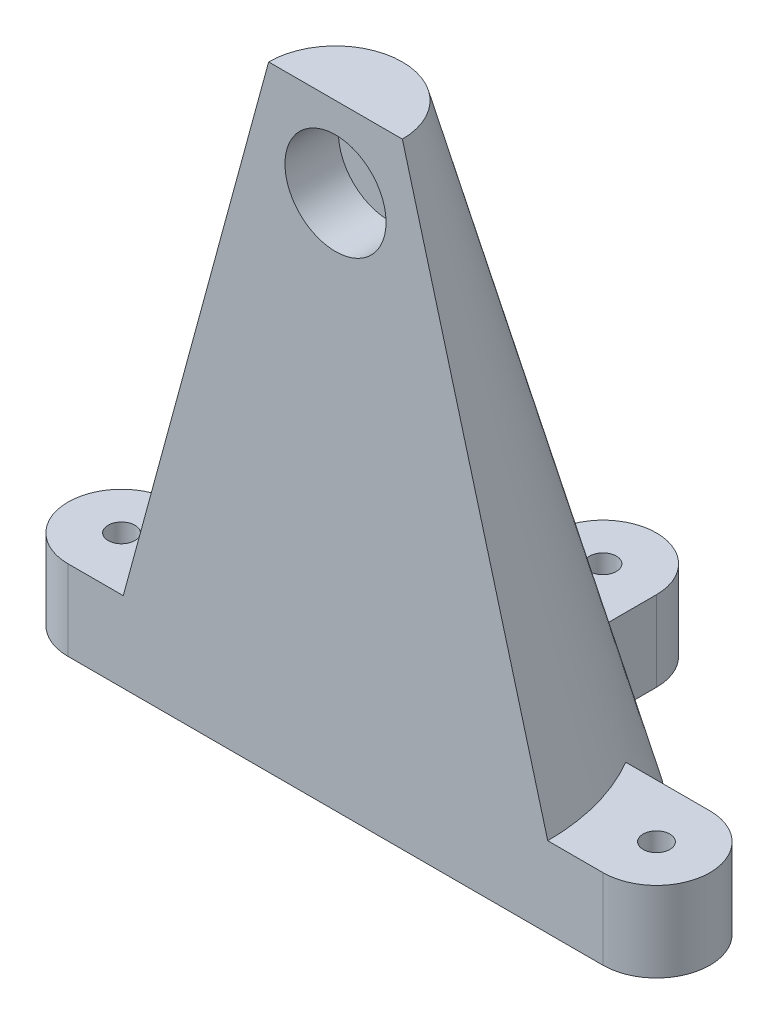
from build123d import *

# Parameters (mm, degrees)
SKETCH3_R           = 1.27
BOSS_EXTRUDE1_DEPTH = 7.62
SKETCH4_R           = 4.8006
CUT_EXTRUDE1_DEPTH  = 5.08


with BuildPart() as part:
    # Sketch1 → Loft1 section 0
    with BuildSketch(Plane(origin=(0, 0, 0), x_dir=(1, 0, 0), z_dir=(0, 1, 0))):
        with BuildLine():
            Line((-22.225, 0), (22.225, 0))
            ThreePointArc((22.225, 0), (0, 22.225), (-22.225, 0))
        make_face()
    # Sketch2 → Loft1 section 1
    with BuildSketch(Plane(origin=(0, 58.42, 0), x_dir=(1, 0, 0), z_dir=(0, 1, 0))):
        with BuildLine():
            Line((-6.35, 0), (6.35, 0))
            ThreePointArc((6.35, 0), (0, 6.35), (-6.35, 0))
        make_face()
    loft()

    # Sketch3 → Boss-Extrude1 (add)
    with BuildSketch(Plane(origin=(0, 0, 0), x_dir=(1, 0, 0), z_dir=(0, 1, 0))):
        with BuildLine():
            Line((5.08, 25.4), (5.08, 10.16))
            Line((5.08, 10.16), (25.4, 10.16))
            ThreePointArc((25.4, 10.16), (30.48, 5.08), (25.4, 0))
            Line((25.4, 0), (-25.4, 0))
            ThreePointArc((-25.4, 0), (-30.48, 5.08), (-25.4, 10.16))
            Line((-25.4, 10.16), (-5.08, 10.16))
            Line((-5.08, 10.16), (-5.08, 25.4))
            ThreePointArc((-5.08, 25.4), (0, 30.48), (5.08, 25.4))
        make_face()
        with Locations(Location((25.4, 5.08, 0), (0, 0, 90))):
            Circle(SKETCH3_R, mode=Mode.SUBTRACT)
        with Locations(Location((-25.4, 5.08, 0), (0, 0, 90))):
            Circle(SKETCH3_R, mode=Mode.SUBTRACT)
        with Locations(Location((0, 25.4, 0), (0, 0, 90))):
            Circle(SKETCH3_R, mode=Mode.SUBTRACT)
    extrude(amount=BOSS_EXTRUDE1_DEPTH)

    # Sketch4 → Cut-Extrude1 (cut)
    with BuildSketch(Plane.XY):
        with Locations((0, 50.8)):
            Circle(SKETCH4_R)
    extrude(amount=-CUT_EXTRUDE1_DEPTH, mode=Mode.SUBTRACT)


solid = part.part
